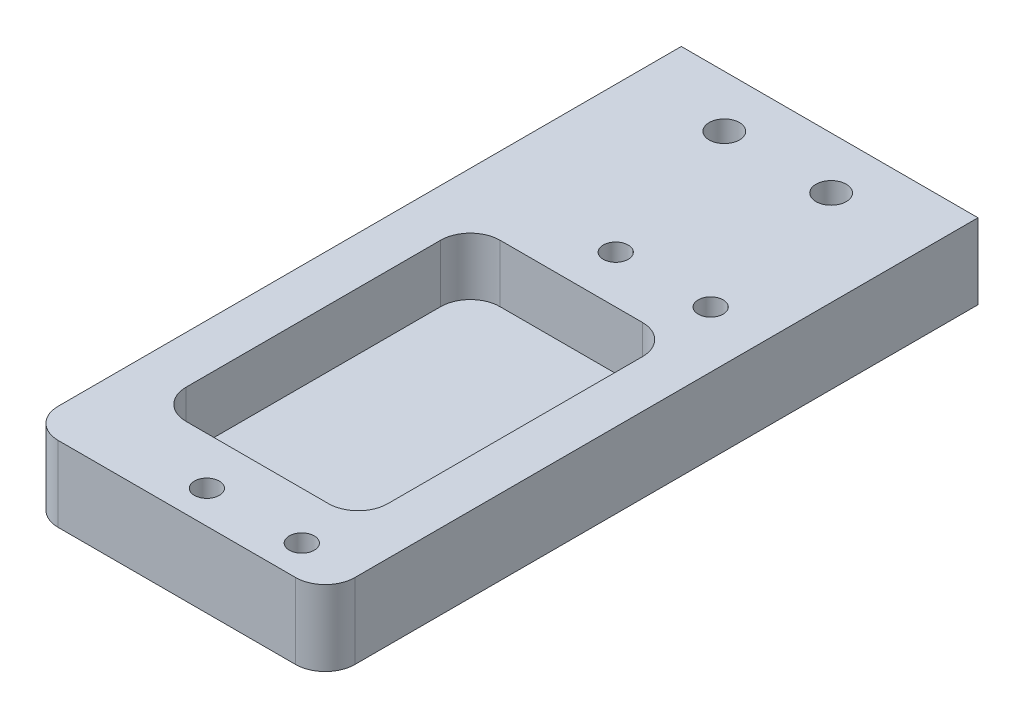
from build123d import *

# Parameters (mm, degrees)
SKETCH12_W                = 50
SKETCH12_H                = 12.7
BOSS_EXTRUDE1_DEPTH       = 110
M5X0_8_TAPPED_HOLE2_D     = 4.2
M5X0_8_TAPPED_HOLE2_DEPTH = 14.4
M5X0_8_TAPPED_HOLE2_TIP   = 1.2618073
M5X0_8_TAPPED_HOLE3_D     = 4.2
SKETCH23_R                = 2.55
CUT_EXTRUDE2_DEPTH        = 114.517795962
SKETCH26_W                = 34
SKETCH26_H                = 52.9
CUT_EXTRUDE1_DEPTH        = 9.7
FILLET1_R                 = 5


with BuildPart() as part:
    # Sketch12 → Boss-Extrude1 (new body)
    with BuildSketch(Plane.XY):
        Rectangle(SKETCH12_W, SKETCH12_H)
    extrude(amount=BOSS_EXTRUDE1_DEPTH)

    # M5x0.8 Tapped Hole2
    with Locations(Plane(origin=(0, 0, 0), x_dir=(-1, 0, 0), z_dir=(0, 0, -1))):
        with Locations((-17.5, 0), (0, 0), (17.5, 0)):
            Hole(M5X0_8_TAPPED_HOLE2_D / 2, depth=M5X0_8_TAPPED_HOLE2_DEPTH)
            with Locations((0, 0, -(M5X0_8_TAPPED_HOLE2_DEPTH + M5X0_8_TAPPED_HOLE2_TIP / 2))):  # 118° drill point
                Cone(0, M5X0_8_TAPPED_HOLE2_D / 2, M5X0_8_TAPPED_HOLE2_TIP, mode=Mode.SUBTRACT)

    # M5x0.8 Tapped Hole3 (through all)
    with Locations(Plane(origin=(0, 6.35, 0), x_dir=(1, 0, 0), z_dir=(0, 1, 0))):
        with Locations((-0.5, -35.55), (15.5, -35.55), (15.5, -104.45), (-0.5, -104.45)):
            Hole(M5X0_8_TAPPED_HOLE3_D / 2)

    # Sketch23 → Cut-Extrude2 (cut, through all)
    with BuildSketch(Plane.XZ.offset(6.35)):
        with Locations(Location((-9, 8.75, 0), (0, 0, 270))):
            Circle(SKETCH23_R)
        with Locations(Location((9, 8.75, 0), (0, 0, 270))):
            Circle(SKETCH23_R)
    extrude(amount=-CUT_EXTRUDE2_DEPTH, mode=Mode.SUBTRACT)

    # Sketch26 → Cut-Extrude1 (cut)
    with BuildSketch(Plane(origin=(0, 6.35, 0), x_dir=(1, 0, 0), z_dir=(0, 1, 0))):
        with Locations((0, -70)):
            Rectangle(SKETCH26_W, SKETCH26_H)
    extrude(amount=-CUT_EXTRUDE1_DEPTH, mode=Mode.SUBTRACT)

    # Fillet1
    fillet1_edges = [part.edges().sort_by_distance(p)[0] for p in [
        (-25, 0, 110),
        (25, 0, 110),
        (-17, 1.5, 96.45),
        (-17, 1.5, 43.55),
        (17, 1.5, 43.55),
        (17, 1.5, 96.45),
    ]]
    fillet(fillet1_edges, radius=FILLET1_R)


solid = part.part
